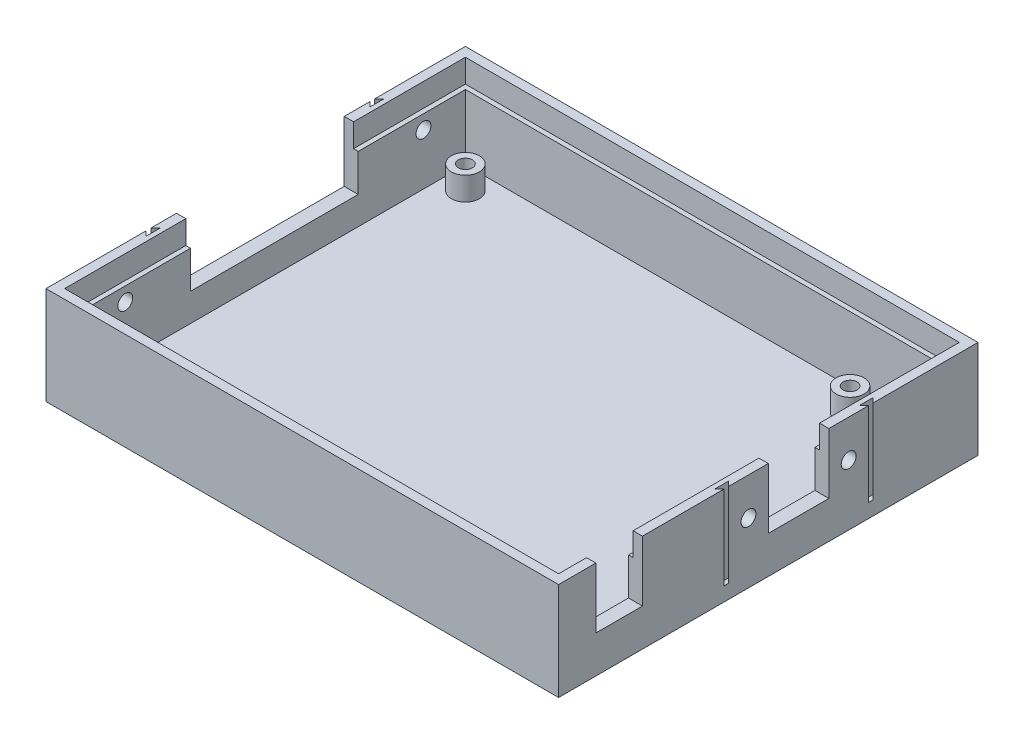
from build123d import *

# Parameters (mm, degrees)
CROQUIS1_W              = 110
CROQUIS1_H              = 90
SALIENTE_EXTRUIR1_DEPTH = 2
CROQUIS3_R              = 3
SALIENTE_EXTRUIR2_DEPTH = 5
CROQUIS4_R              = 1.5
CORTAR_EXTRUIR1_DEPTH   = 4
CROQUIS5_W              = 3
CROQUIS5_H              = 27
SALIENTE_EXTRUIR3_DEPTH = 19
CROQUIS6_W              = 3
CROQUIS6_H              = 36
CROQUIS6_H_2            = 13
CROQUIS6_H_3            = 10
SALIENTE_EXTRUIR4_DEPTH = 6
CROQUIS7_W              = 106
CROQUIS7_H              = 86
CROQUIS7_W_2            = 104
CROQUIS7_H_2            = 84
CORTAR_EXTRUIR2_DEPTH   = 5
CORTAR_EXTRUIR3_DEPTH   = 18
CROQUIS9_R              = 1.6
CORTAR_EXTRUIR4_DEPTH   = 12
CORTAR_EXTRUIR5_DEPTH   = 18
CROQUIS14_R             = 1.6
CORTAR_EXTRUIR6_DEPTH   = 10


with BuildPart() as part:
    # Croquis1 → Saliente-Extruir1 (new body)
    with BuildSketch(Plane(origin=(0, 0, 0), x_dir=(1, 0, 0), z_dir=(0, 1, 0))):
        Rectangle(CROQUIS1_W, CROQUIS1_H)
    extrude(amount=SALIENTE_EXTRUIR1_DEPTH)

    # Croquis3 → Saliente-Extruir2 (add)
    with BuildSketch(Plane(origin=(0, 2, 0), x_dir=(1, 0, 0), z_dir=(0, 1, 0))):
        with Locations(Location((-47.19, -37.19, 0), (0, 0, 90))):
            Circle(CROQUIS3_R)
        with Locations(Location((-47.19, 37.19, 0), (0, 0, 90))):
            Circle(CROQUIS3_R)
        with Locations(Location((35.36, -37.19, 0), (0, 0, 90))):
            Circle(CROQUIS3_R)
        with Locations(Location((35.36, 37.19, 0), (0, 0, 90))):
            Circle(CROQUIS3_R)
    extrude(amount=SALIENTE_EXTRUIR2_DEPTH)

    # Croquis4 → Cortar-Extruir1 (cut)
    with BuildSketch(Plane(origin=(0, 7, 0), x_dir=(1, 0, 0), z_dir=(0, 1, 0))):
        with Locations(Location((-47.19, -37.19, 0), (0, 0, 270))):
            Circle(CROQUIS4_R)
        with Locations(Location((35.36, -37.19, 0), (0, 0, 270))):
            Circle(CROQUIS4_R)
        with Locations(Location((35.36, 37.19, 0), (0, 0, 270))):
            Circle(CROQUIS4_R)
        with Locations(Location((-47.19, 37.19, 0), (0, 0, 270))):
            Circle(CROQUIS4_R)
    extrude(amount=-CORTAR_EXTRUIR1_DEPTH, mode=Mode.SUBTRACT)

    # Croquis5 → Saliente-Extruir3 (add)
    with BuildSketch(Plane(origin=(0, 2, 0), x_dir=(1, 0, 0), z_dir=(0, 1, 0))):
        Polygon((52, -37), (55, -37), (55, -45), (-55, -45), (-55, -17), (-52, -17), (-52, -42), (52, -42), align=None)
        Polygon((-55, 45), (55, 45), (55, 13), (52, 13), (52, 42), (-52, 42), (-52, 19), (-55, 19), align=None)
        with Locations((53.5, -13.5)):
            Rectangle(CROQUIS5_W, CROQUIS5_H)
    extrude(amount=SALIENTE_EXTRUIR3_DEPTH)

    # Croquis6 → Saliente-Extruir4 (add)
    with BuildSketch(Plane(origin=(0, 2, 0), x_dir=(1, 0, 0), z_dir=(0, 1, 0))):
        with Locations((-53.5, 1)):
            Rectangle(CROQUIS6_W, CROQUIS6_H)
        with Locations((53.5, 6.5)):
            Rectangle(CROQUIS6_W, CROQUIS6_H_2)
        with Locations((53.5, -32)):
            Rectangle(CROQUIS6_W, CROQUIS6_H_3)
    extrude(amount=SALIENTE_EXTRUIR4_DEPTH)

    # Croquis7 → Cortar-Extruir2 (cut)
    with BuildSketch(Plane(origin=(0, 21, 0), x_dir=(1, 0, 0), z_dir=(0, 1, 0))):
        Rectangle(CROQUIS7_W, CROQUIS7_H)
        Rectangle(CROQUIS7_W_2, CROQUIS7_H_2, mode=Mode.SUBTRACT)
    extrude(amount=-CORTAR_EXTRUIR2_DEPTH, mode=Mode.SUBTRACT)

    # Croquis8 → Cortar-Extruir3 (cut)
    with BuildSketch(Plane(origin=(0, 21, 0), x_dir=(1, 0, 0), z_dir=(0, 1, 0))):
        Polygon((55, -8.5), (54, -7.5), (54, -10.5), (55, -9.5), align=None)
        Polygon((55, 22.5), (55, 21.5), (54, 20.5), (54, 23.5), align=None)
    extrude(amount=-CORTAR_EXTRUIR3_DEPTH, mode=Mode.SUBTRACT)

    # Croquis9 → Cortar-Extruir4 (cut)
    with BuildSketch(Plane(origin=(55, 0, 0), x_dir=(0, 0, -1), z_dir=(1, 0, 0))):
        with Locations((-4.25, 13)):
            Circle(CROQUIS9_R)
        with Locations((17.25, 13)):
            Circle(CROQUIS9_R)
    extrude(amount=-CORTAR_EXTRUIR4_DEPTH, mode=Mode.SUBTRACT)

    # Croquis11 → Cortar-Extruir5 (cut)
    with BuildSketch(Plane(origin=(0, 21, 0), x_dir=(1, 0, 0), z_dir=(0, 1, 0))):
        Polygon((-55, -22.5), (-54, -21.5), (-54, -24.5), (-55, -23.5), align=None)
        Polygon((-55, 25.5), (-55, 24.5), (-54, 23.5), (-54, 26.5), align=None)
    extrude(amount=-CORTAR_EXTRUIR5_DEPTH, mode=Mode.SUBTRACT)

    # Croquis14 → Cortar-Extruir6 (cut)
    with BuildSketch(Plane.ZY.offset(55)):
        with Locations((-33, 13)):
            Circle(CROQUIS14_R)
        with Locations((31, 13)):
            Circle(CROQUIS14_R)
    extrude(amount=-CORTAR_EXTRUIR6_DEPTH, mode=Mode.SUBTRACT)


solid = part.part
